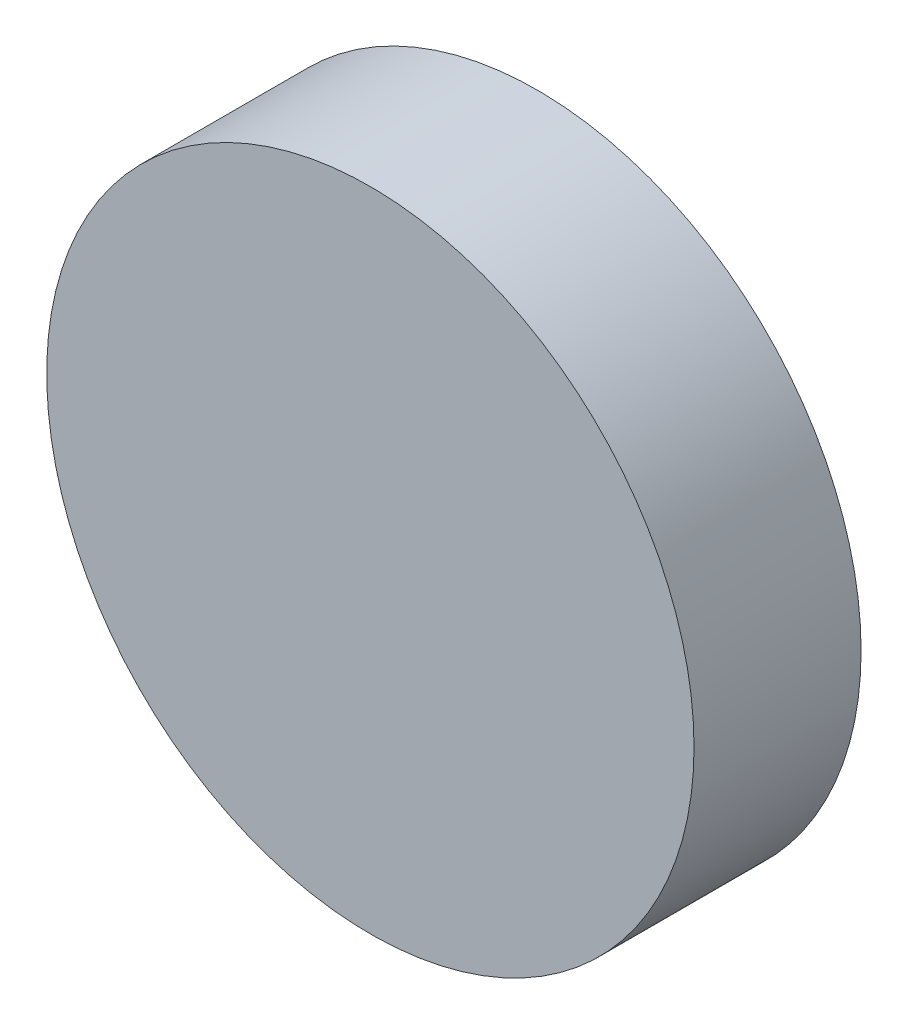
from build123d import *

# Parameters (mm, degrees)
SKETCH1_R           = 7.75
BOSS_EXTRUDE1_DEPTH = 4
FILLET1_R           = 0.05


with BuildPart() as part:
    # Sketch1 → Boss-Extrude1 (new body)
    with BuildSketch(Plane.XY):
        Circle(SKETCH1_R)
    extrude(amount=BOSS_EXTRUDE1_DEPTH)

    # Sketch2 → Cut-Revolve1 (revolve, cut)
    with BuildSketch(Plane(origin=(0, 0, 0), x_dir=(0, 0, -1), z_dir=(1, 0, 0)), mode=Mode.PRIVATE) as cut_revolve1_sk:
        with BuildLine():
            Line((-0.4, 0.91), (-2.1, 0.91))
            ThreePointArc((-2.1, 0.91), (-2.743467171, 0.643467171), (-3.01, 0))
            Line((-3.01, 0), (0.05, 0))
            Line((0.05, 0), (0.05, 1.08))
            Line((0.05, 1.08), (-0.4, 1.08))
            Line((-0.4, 1.08), (-0.4, 0.91))
        make_face()
    revolve(cut_revolve1_sk.sketch.rotate(Axis((0, 0, 3.01), (0, 0, -1)), 180), axis=Axis((0, 0, 3.01), (0, 0, -1)), mode=Mode.SUBTRACT)

    # Fillet1
    fillet1_edges = [part.edges().sort_by_distance(p)[0] for p in [
        (0, 0.91, 0.4),
    ]]
    fillet(fillet1_edges, radius=FILLET1_R)


solid = part.part
